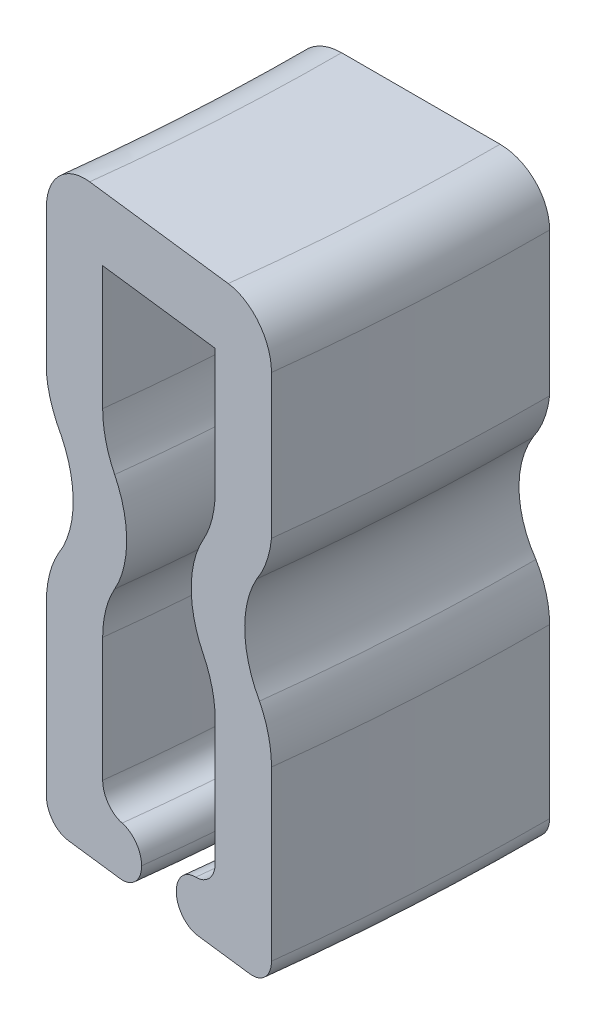
from build123d import *


with BuildPart() as part:
    # Sweep2: sweep along a path in Sketch12
    with BuildLine(Plane(origin=(0, 0, 0), x_dir=(1, 0, 0), z_dir=(0, 1, 0))) as sweep2_path:
        ThreePointArc((0, 0), (-0.074470784, -2.5), (-0.297619048, -4.99113443))
    # Sketch2 → Sweep2 (sweep)
    with BuildSketch(Plane.XY):
        with BuildLine():
            Line((-1.3, 7.7), (1.3, 7.7))
            Line((1.3, 7.7), (1.3, 5.2))
            ThreePointArc((1.3, 5.2), (1.229474497, 4.681174375), (1.023016035, 4.2))
            ThreePointArc((1.023016035, 4.2), (0.74603207, 3.2), (1.023016035, 2.2))
            ThreePointArc((1.023016035, 2.2), (1.229474497, 1.718825625), (1.3, 1.2))
            Line((1.3, 1.2), (1.3, -1.3))
            ThreePointArc((1.3, -1.3), (1.170809924, -1.635410197), (0.85, -1.797493719))
            ThreePointArc((0.85, -1.797493719), (0.529190076, -1.95957724), (0.4, -2.294987437))
            ThreePointArc((0.4, -2.294987437), (0.546446609, -2.648540828), (0.9, -2.794987437))
            Line((0.9, -2.794987437), (2.1, -2.794987437))
            ThreePointArc((2.1, -2.794987437), (2.453553391, -2.648540828), (2.6, -2.294987437))
            Line((2.6, -2.294987437), (2.6, 1.1))
            ThreePointArc((2.6, 1.1), (2.529474497, 1.618825625), (2.323016035, 2.1))
            ThreePointArc((2.323016035, 2.1), (1.982702832, 3.140572492), (2.258778081, 4.2))
            ThreePointArc((2.258778081, 4.2), (2.485981176, 4.628543914), (2.6, 5.1))
            Line((2.6, 5.1), (2.6, 8))
            ThreePointArc((2.6, 8), (2.307106781, 8.707106781), (1.6, 9))
            Line((1.6, 9), (-1.6, 9))
            ThreePointArc((-1.6, 9), (-2.307106781, 8.707106781), (-2.6, 8))
            Line((-2.6, 8), (-2.6, 5.1))
            ThreePointArc((-2.6, 5.1), (-2.485981176, 4.628543914), (-2.258778081, 4.2))
            ThreePointArc((-2.258778081, 4.2), (-1.982702832, 3.140572492), (-2.323016035, 2.1))
            ThreePointArc((-2.323016035, 2.1), (-2.529474497, 1.618825625), (-2.6, 1.1))
            Line((-2.6, 1.1), (-2.6, -2.294987437))
            ThreePointArc((-2.6, -2.294987437), (-2.453553391, -2.648540828), (-2.1, -2.794987437))
            Line((-2.1, -2.794987437), (-0.9, -2.794987437))
            ThreePointArc((-0.9, -2.794987437), (-0.546446609, -2.648540828), (-0.4, -2.294987437))
            ThreePointArc((-0.4, -2.294987437), (-0.529190076, -1.95957724), (-0.85, -1.797493719))
            ThreePointArc((-0.85, -1.797493719), (-1.170809924, -1.635410197), (-1.3, -1.3))
            Line((-1.3, -1.3), (-1.3, 1.2))
            ThreePointArc((-1.3, 1.2), (-1.229474497, 1.718825625), (-1.023016035, 2.2))
            ThreePointArc((-1.023016035, 2.2), (-0.74603207, 3.2), (-1.023016035, 4.2))
            ThreePointArc((-1.023016035, 4.2), (-1.229474497, 4.681174375), (-1.3, 5.2))
            Line((-1.3, 5.2), (-1.3, 7.7))
        make_face()
    sweep(path=sweep2_path.line)


solid = part.part
